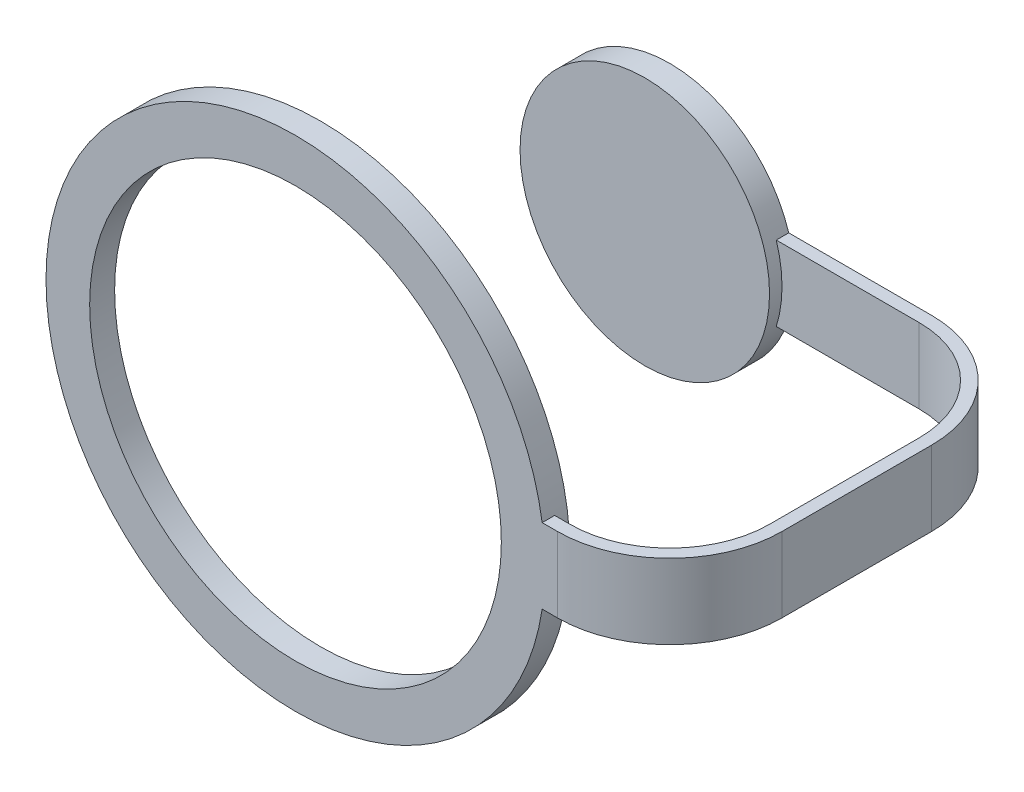
from build123d import *

# Parameters (mm, degrees)
SKETCH7_R                = 10
SKETCH7_R_2              = 8.25
BOSS_EXTRUDE3_DEPTH      = 1
SKETCH8_R                = 5
BOSS_EXTRUDE4_DEPTH      = 1
BOSS_EXTRUDE5_DEPTH      = 1.5
BOSS_EXTRUDE5_DEPTH_BACK = 1.5


with BuildPart() as part:
    # Sketch7 → Boss-Extrude3 (new body)
    with BuildSketch(Plane.XY.offset(13)):
        Circle(SKETCH7_R)
        Circle(SKETCH7_R_2, mode=Mode.SUBTRACT)
    extrude(amount=BOSS_EXTRUDE3_DEPTH)



with BuildPart() as body_2:
    # Sketch8 → Boss-Extrude4 (new body)
    with BuildSketch(Plane.XY):
        Circle(SKETCH8_R)
    extrude(amount=-BOSS_EXTRUDE4_DEPTH)


with BuildPart() as part_1:
    add(part.part)

    add(body_2.part)  # Boss-Extrude5 merges body 2
    # Sketch9 → Boss-Extrude5 (add, two sides: drawn at the far end of the back side and taken through both)
    with BuildSketch(Plane(origin=(0, 0, 0), x_dir=(1, 0, 0), z_dir=(0, 1, 0)).offset(-BOSS_EXTRUDE5_DEPTH_BACK)):
        with BuildLine():
            Line((10, -13.5), (10.5, -13.5))
            ThreePointArc((10.5, -13.5), (13.328427125, -12.328427125), (14.5, -9.5))
            Line((14.5, -9.5), (14.5, -3.5))
            ThreePointArc((14.5, -3.5), (13.328427125, -0.671572875), (10.5, 0.5))
            Line((10.5, 0.5), (5, 0.5))
            Line((5, 0.5), (4.7, 0.5))
            Line((4.7, 0.5), (4.7, 1))
            Line((4.7, 1), (5, 1))
            Line((5, 1), (10.5, 1))
            ThreePointArc((10.5, 1), (13.681980515, -0.318019485), (15, -3.5))
            Line((15, -3.5), (15, -9.5))
            ThreePointArc((15, -9.5), (13.681980515, -12.681980515), (10.5, -14))
            Line((10.5, -14), (10, -14))
            Line((10, -14), (9.7, -14))
            Line((9.7, -14), (9.7, -13.5))
            Line((9.7, -13.5), (10, -13.5))
        make_face()
    extrude(amount=BOSS_EXTRUDE5_DEPTH + BOSS_EXTRUDE5_DEPTH_BACK)


solid = part_1.part
